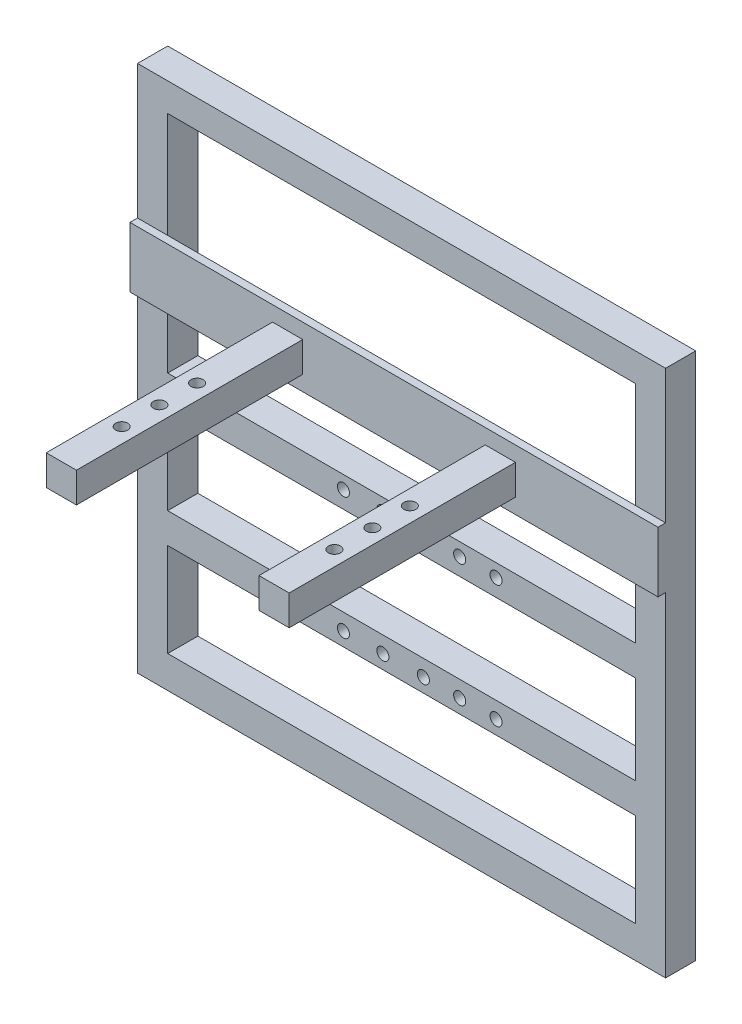
from build123d import *

# Parameters (mm, degrees)
SKETCH1_W           = 350
SKETCH1_H           = 350
SKETCH1_W_2         = 310
SKETCH1_H_2         = 59
SKETCH1_H_3         = 149
SKETCH1_H_4         = 62
BOSS_EXTRUDE1_DEPTH = 20
SKETCH2_W           = 350
SKETCH2_H           = 40
BOSS_EXTRUDE2_DEPTH = 5
SKETCH3_W           = 20
SKETCH3_H           = 20
BOSS_EXTRUDE4_DEPTH = 150
SKETCH4_R           = 4
CUT_EXTRUDE1_DEPTH  = 339.914592404
SKETCH5_R           = 4
CUT_EXTRUDE2_DEPTH  = 351.735228342
SKETCH6_R           = 4
CUT_EXTRUDE3_DEPTH  = 339.914592404


with BuildPart() as part:
    # Sketch1 → Boss-Extrude1 (new body)
    with BuildSketch(Plane.XY):
        with Locations((-0.376590763, -86.214953271)):
            Rectangle(SKETCH1_W, SKETCH1_H)
        with Locations((-0.376590763, -128.45502947)):
            Rectangle(SKETCH1_W_2, SKETCH1_H_2, mode=Mode.SUBTRACT)
        with Locations((-0.376590763, -4.45502947)):
            Rectangle(SKETCH1_W_2, SKETCH1_H_3, mode=Mode.SUBTRACT)
        with Locations((-0.376590763, -208.95502947)):
            Rectangle(SKETCH1_W_2, SKETCH1_H_4, mode=Mode.SUBTRACT)
    extrude(amount=BOSS_EXTRUDE1_DEPTH)

    # Sketch2 → Boss-Extrude2 (add)
    with BuildSketch(Plane.XY.offset(20)):
        with Locations((-0.376590763, -19.95502947)):
            Rectangle(SKETCH2_W, SKETCH2_H)
    extrude(amount=BOSS_EXTRUDE2_DEPTH)

    # Sketch3 → Boss-Extrude4 (add)
    with BuildSketch(Plane.XY.offset(25)):
        with Locations((-70.876590763, -19.95502947)):
            Rectangle(SKETCH3_W, SKETCH3_H)
        with Locations((70.123409237, -19.95502947)):
            Rectangle(SKETCH3_W, SKETCH3_H)
    extrude(amount=BOSS_EXTRUDE4_DEPTH)

    # Sketch4 → Cut-Extrude1 (cut, through all)
    with BuildSketch(Plane.XZ.offset(29.95502947)):
        with Locations(Location((-70.876590763, 135, 0), (0, 0, 270))):
            Circle(SKETCH4_R)
        with Locations(Location((-70.876590763, 85, 0), (0, 0, 270))):
            Circle(SKETCH4_R)
        with Locations(Location((70.123409237, 135, 0), (0, 0, 270))):
            Circle(SKETCH4_R)
        with Locations(Location((70.123409237, 85, 0), (0, 0, 270))):
            Circle(SKETCH4_R)
    extrude(amount=-CUT_EXTRUDE1_DEPTH, mode=Mode.SUBTRACT)

    # Sketch5 → Cut-Extrude2 (cut, through all)
    with BuildSketch(Plane.XY.offset(20)):
        with Locations((-38.918433774, -87.591447664)):
            Circle(SKETCH5_R)
        with Locations((-12.765040303, -87.591447664)):
            Circle(SKETCH5_R)
        with Locations((14.076600366, -87.591447664)):
            Circle(SKETCH5_R)
        with Locations((38.165252248, -87.591447664)):
            Circle(SKETCH5_R)
        with Locations((62.25390413, -87.591447664)):
            Circle(SKETCH5_R)
        with Locations((62.25390413, -168.804616866)):
            Circle(SKETCH5_R)
        with Locations((38.165252248, -168.804616866)):
            Circle(SKETCH5_R)
        with Locations((14.076600366, -168.804616866)):
            Circle(SKETCH5_R)
        with Locations((-12.765040303, -168.804616866)):
            Circle(SKETCH5_R)
        with Locations((-38.918433774, -168.804616866)):
            Circle(SKETCH5_R)
    extrude(amount=-CUT_EXTRUDE2_DEPTH, mode=Mode.SUBTRACT)

    # Sketch6 → Cut-Extrude3 (cut, through all)
    with BuildSketch(Plane.XZ.offset(29.95502947)):
        with Locations(Location((-70.876590763, 110, 0), (0, 0, 270))):
            Circle(SKETCH6_R)
        with Locations(Location((70.285399923, 110, 0), (0, 0, 270))):
            Circle(SKETCH6_R)
    extrude(amount=-CUT_EXTRUDE3_DEPTH, mode=Mode.SUBTRACT)


solid = part.part
